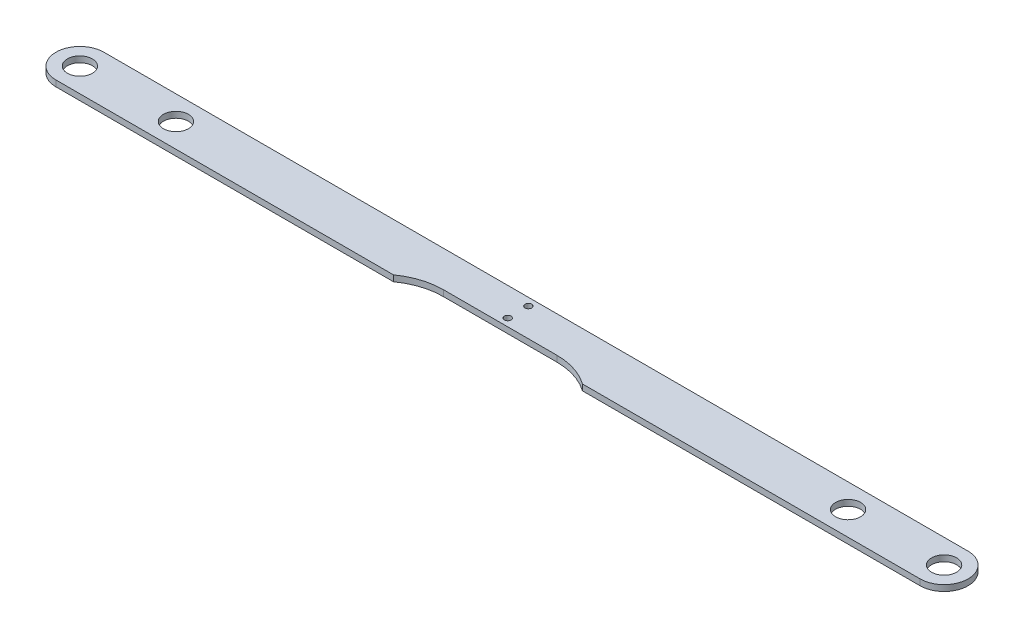
from build123d import *

# Parameters (mm, degrees)
SKETCH5_R           = 3.302
BOSS_EXTRUDE1_DEPTH = 1.5875
SKETCH6_R           = 0.89
CUT_EXTRUDE2_DEPTH  = 121.922062322


with BuildPart() as part:
    # Sketch5 → Boss-Extrude1 (new body)
    with BuildSketch(Plane(origin=(0, 0, 0), x_dir=(1, 0, 0), z_dir=(0, 1, 0))):
        with BuildLine():
            Line((0, 4.75), (-114.3, 4.75))
            ThreePointArc((-114.3, 4.75), (-120.65, -1.6), (-114.3, -7.95))
            Line((-114.3, -7.95), (-25, -7.95))
            ThreePointArc((-25, -7.95), (-20.249761899, -5.569494064), (-15, -4.75))
            Line((-15, -4.75), (0, -4.75))
            Line((0, -4.75), (0, 4.75))
        make_face()
        with Locations(Location((-114.3, -1.6, 0), (0, 0, 270))):
            Circle(SKETCH5_R, mode=Mode.SUBTRACT)
        with Locations(Location((-88.9, -1.6, 0), (0, 0, 270))):
            Circle(SKETCH5_R, mode=Mode.SUBTRACT)
    boss_extrude1 = extrude(amount=BOSS_EXTRUDE1_DEPTH)

    # Mirror1: Boss-Extrude1 across plane
    add(boss_extrude1.mirror(Plane(origin=(0, 1.5875, -4.75), x_dir=(0, 0, 1), z_dir=(-1, 0, 0))))

    # Sketch6 → Cut-Extrude2 (cut, through all)
    with BuildSketch(Plane(origin=(0, 0, 0), x_dir=(1, 0, 0), z_dir=(0, 1, 0))):
        with Locations(Location((0, 2.75, 0), (0, 0, 270))):
            Circle(SKETCH6_R)
        with Locations(Location((0, -2.75, 0), (0, 0, 270))):
            Circle(SKETCH6_R)
    extrude(amount=CUT_EXTRUDE2_DEPTH, mode=Mode.SUBTRACT)


solid = part.part
